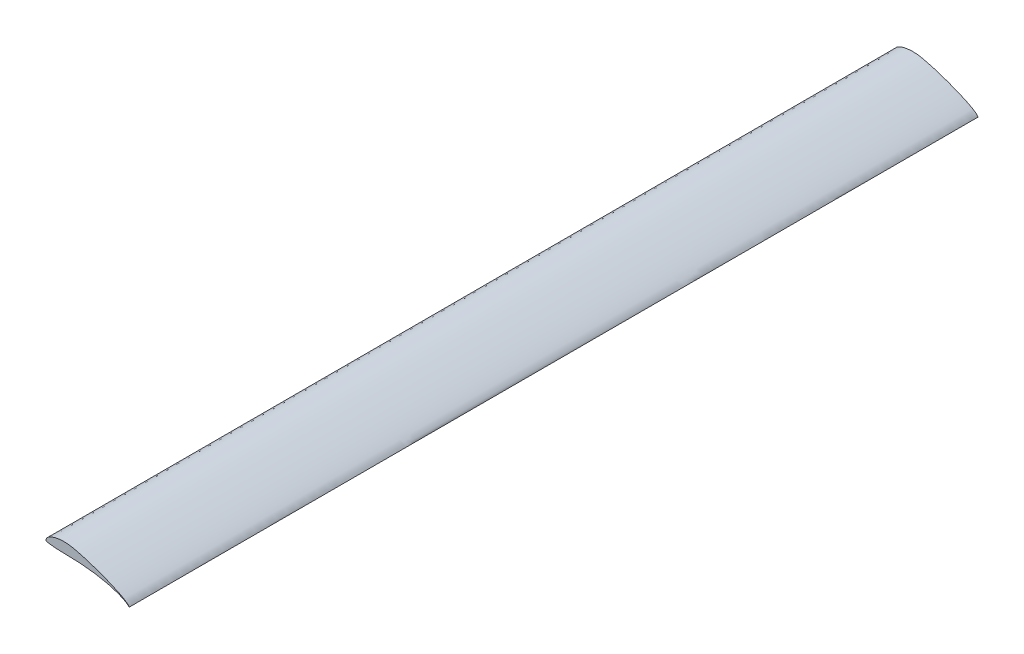
from build123d import *

# Parameters (mm, degrees)
BOSS_EXTRUDE1_DEPTH = 200


with BuildPart() as part:
    # Sketch1 → Boss-Extrude1 (new body)
    with BuildSketch(Plane.XY):
        with BuildLine():
            add(Edge.make_bspline(
                [(17.989875606, -2.313425292), (17.990095576, -2.312950775), (17.935582172, -2.251710288), (17.892127137, -2.18705956), (17.794189981, -2.050546547), (17.675981645, -1.902434975), (17.505484664, -1.742550604), (17.286706277, -1.576576405), (17.018680599, -1.395185163), (16.701507032, -1.200154443), (16.336603809, -0.992692625), (15.925774012, -0.774319819), (15.471342122, -0.54614257), (14.975719985, -0.30989336), (14.441709219, -0.067120475), (13.872485161, 0.180692699), (13.271548673, 0.432153869), (12.64224895, 0.685001871), (11.988667355, 0.938220063), (11.314403822, 1.189539674), (10.624005898, 1.438243721), (9.921866312, 1.68258343), (9.213150331, 1.921175871), (8.503799491, 2.153453259), (7.799397468, 2.376090938), (7.105520947, 2.586488661), (6.426393325, 2.779977729), (5.765388334, 2.952997454), (5.125390268, 3.100734383), (4.51035221, 3.225706559), (3.91903919, 3.316113771), (3.350725584, 3.36957995), (2.804311123, 3.392213514), (2.279620308, 3.383808113), (1.778444519, 3.350453142), (1.303268032, 3.294055871), (0.856694825, 3.217687393), (0.441471471, 3.121683955), (0.059542679, 3.009330402), (-0.286789882, 2.882324881), (-0.595069069, 2.742848925), (-0.864334258, 2.59500681), (-1.091701543, 2.435985448), (-1.275930437, 2.267312006), (-1.421575682, 2.096298361), (-1.527172838, 1.927197272), (-1.594325685, 1.764873966), (-1.617516165, 1.62066596), (-1.607716911, 1.48200536), (-1.484342263, 1.388765927), (-1.302325377, 1.341762995), (-1.052577162, 1.281103797), (-0.733399866, 1.229590016), (-0.350647348, 1.176895796), (0.092231769, 1.127545465), (0.590602884, 1.081545254), (1.142330502, 1.040550359), (1.749698437, 1.016979086), (2.414953948, 1.007269418), (3.138424337, 0.996813393), (3.916014749, 0.982949864), (4.741823037, 0.960822688), (5.608902122, 0.926310275), (6.509795516, 0.876137643), (7.435988756, 0.807092598), (8.378668934, 0.7174464), (9.328199372, 0.604492396), (10.274790181, 0.468096237), (11.208215094, 0.308047474), (12.11806918, 0.1247281), (12.994155971, -0.080038178), (13.826501257, -0.303627463), (14.605105251, -0.543307197), (15.3211132, -0.794208835), (15.965529824, -1.051478376), (16.531335252, -1.309498694), (17.008975695, -1.559272102), (17.392430159, -1.799835161), (17.659577147, -2.0027301), (17.851063583, -2.178897811), (17.924548082, -2.246944615), (17.989651164, -2.313909455), (17.989875606, -2.313425292)],
                knots=[0, 0, 0, 0, 0.000979678, 0.003648862, 0.007483499, 0.012095277, 0.017525591, 0.02405178, 0.031783051, 0.040677828, 0.050710301, 0.061833229, 0.07398925, 0.087118173, 0.101145049, 0.115990637, 0.131570422, 0.147788379, 0.164550917, 0.181757895, 0.199311955, 0.217095072, 0.234990228, 0.252856883, 0.270540594, 0.287886779, 0.304773438, 0.321101419, 0.336806063, 0.351800033, 0.366031063, 0.379615675, 0.392652963, 0.405170359, 0.417171919, 0.428603517, 0.439418959, 0.449596586, 0.459102079, 0.467907878, 0.475988301, 0.483308969, 0.489874508, 0.49580325, 0.501149412, 0.505903073, 0.510046769, 0.513579311, 0.516446927, 0.519350053, 0.523823355, 0.529973794, 0.537715654, 0.546967844, 0.557637367, 0.569620481, 0.582804124, 0.597246961, 0.613135037, 0.6304436, 0.649056124, 0.668822257, 0.689594964, 0.711189651, 0.733426689, 0.756094118, 0.778988554, 0.801889683, 0.824566598, 0.846792285, 0.868338291, 0.888978163, 0.908492011, 0.926658768, 0.943286193, 0.95816921, 0.971135822, 0.981955623, 0.990251791, 0.995852565, 0.999000406, 1, 1, 1, 1], degree=3))
        make_face()
    extrude(amount=BOSS_EXTRUDE1_DEPTH)


solid = part.part
